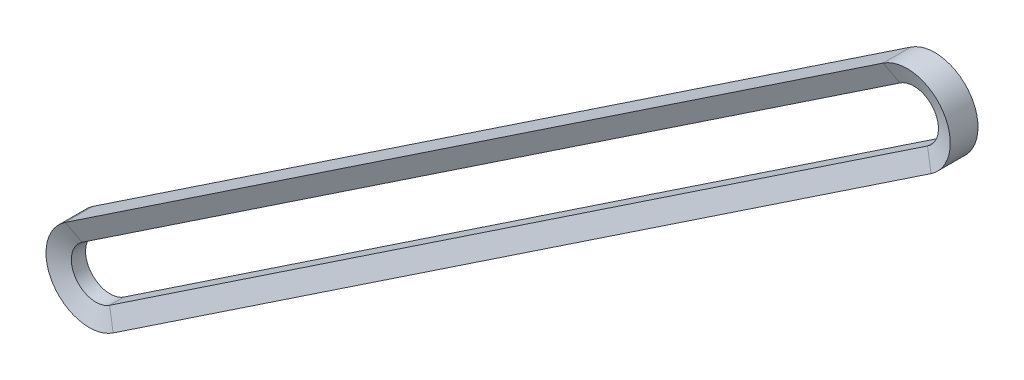
from build123d import *


with BuildPart() as part:
    # 扫描2: sweep along a path in 草图2
    with BuildLine(Plane.XY) as sweep_2_path:
        Line((9.577761756, 0.02879138), (-166.649552908, -117.812646038))
        ThreePointArc((-166.649552908, -117.812646038), (-174.001380423, -116.352977522), (-172.541711908, -109.001150006))
        Line((-172.541711908, -109.001150006), (3.685602756, 8.840287412))
        ThreePointArc((3.685602756, 8.840287412), (11.037430272, 7.380618896), (9.577761756, 0.02879138))
    # 草图3 → 扫描2 (sweep)
    with BuildSketch(Plane(origin=(9.577761756, 0.02879138, 0), x_dir=(0, 0, -1), z_dir=(-0.8312732105360424, -0.5558640566227507, 0))):
        Polygon((-1.535, -10.6), (1.535, -10.6), (2.990880937, -14.6), (-2.990880937, -14.6), align=None)
    sweep(path=sweep_2_path.line)


solid = part.part
